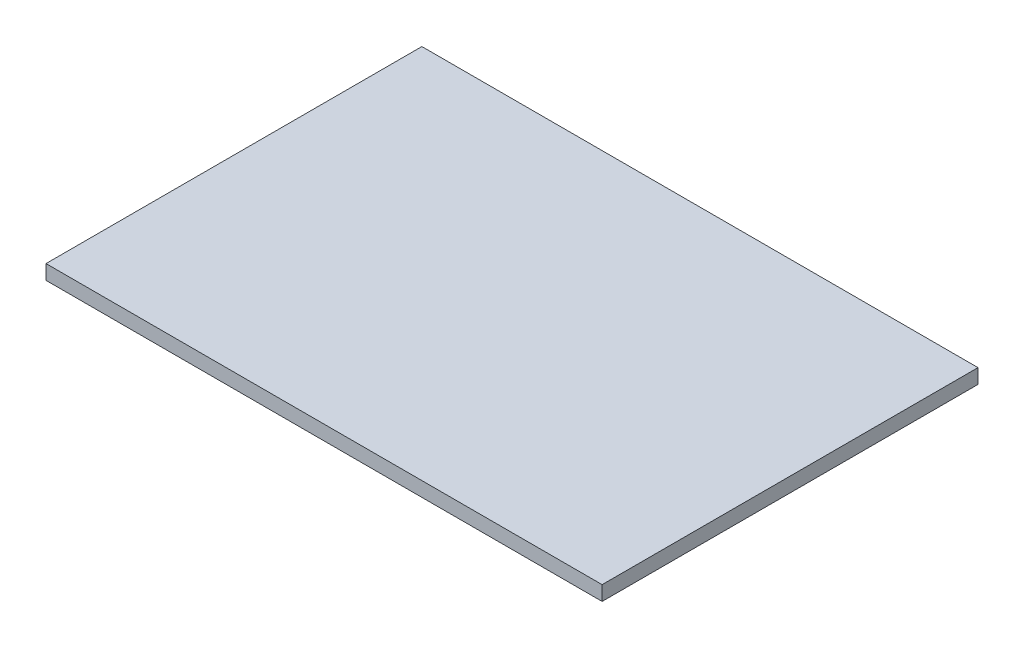
from build123d import *

# Parameters (mm, degrees)
SKETCH1_W           = 90.1
SKETCH1_H           = 60.9
BOSS_EXTRUDE1_DEPTH = 1.18


with BuildPart() as part:
    # Sketch1 → Boss-Extrude1 (new, symmetric)
    with BuildSketch(Plane(origin=(0, 0, 0), x_dir=(1, 0, 0), z_dir=(0, 1, 0))):
        Rectangle(SKETCH1_W, SKETCH1_H)
    extrude(amount=BOSS_EXTRUDE1_DEPTH, both=True)


solid = part.part
